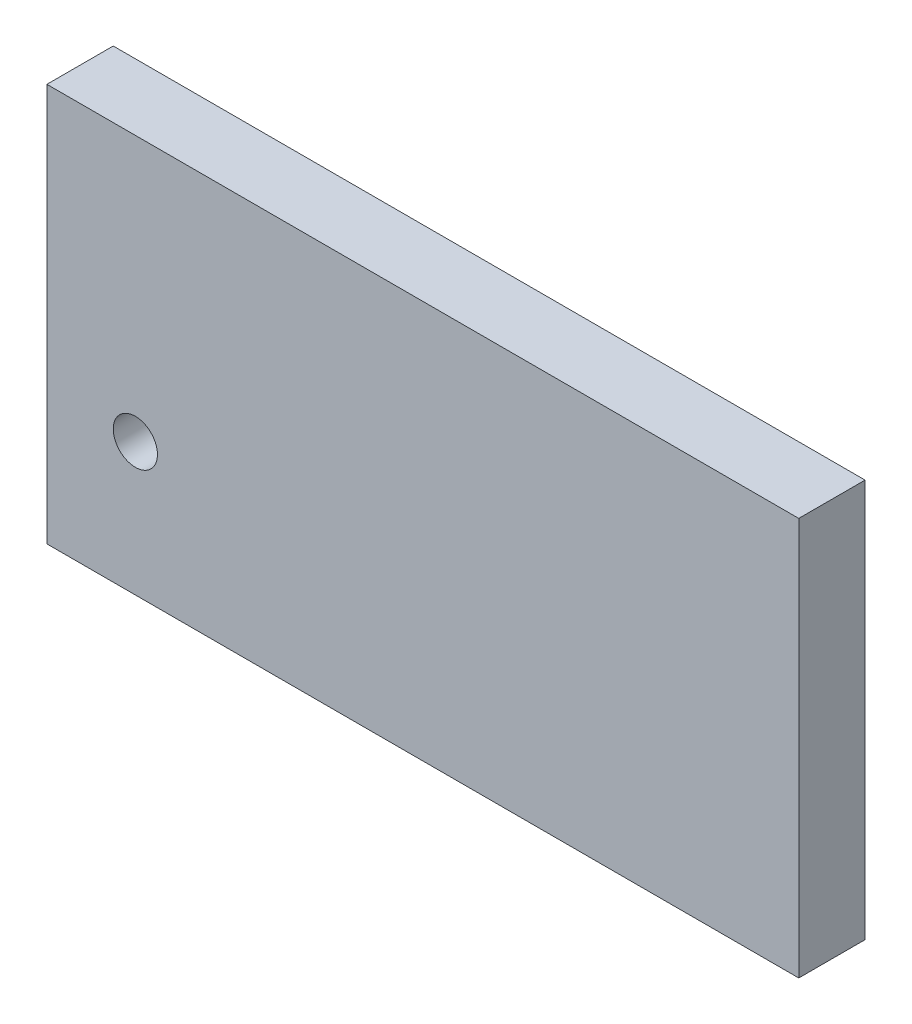
from build123d import *

# Parameters (mm, degrees)
SKETCH2_W           = 215.9
SKETCH2_H           = 114.3
SKETCH2_R           = 6.35
BOSS_EXTRUDE1_DEPTH = 19.05


with BuildPart() as part:
    # Sketch2 → Boss-Extrude1 (new body)
    with BuildSketch(Plane.XY):
        with Locations((359.786295427, 84.34467147)):
            Rectangle(SKETCH2_W, SKETCH2_H)
        with Locations(Location((277.236295427, 65.29467147, 0), (0, 0, 180))):
            Circle(SKETCH2_R, mode=Mode.SUBTRACT)
    extrude(amount=BOSS_EXTRUDE1_DEPTH)


solid = part.part
